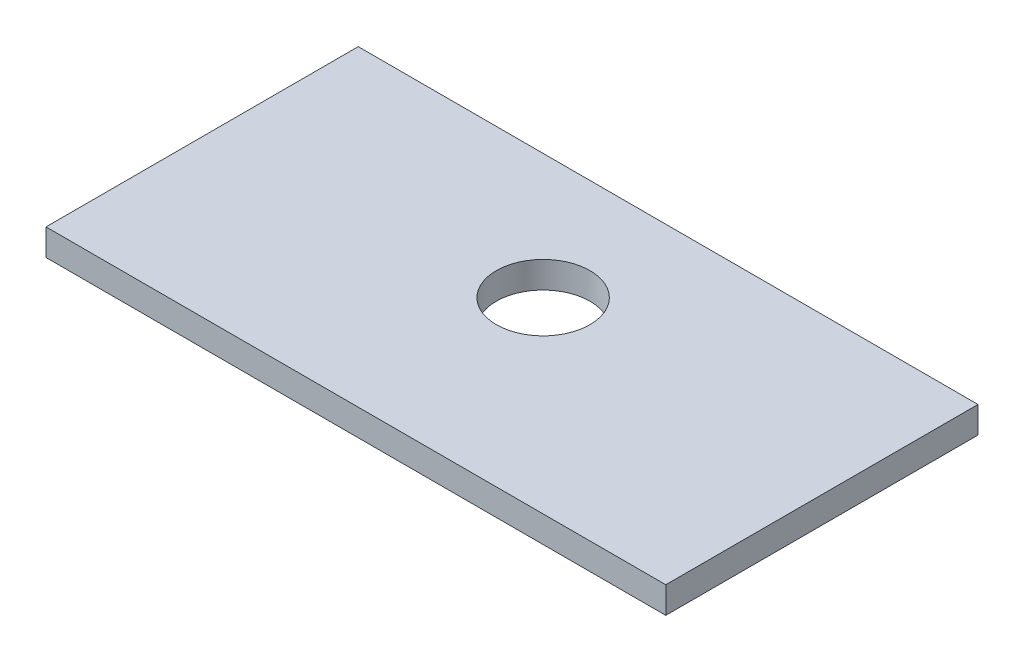
from build123d import *

# Parameters (mm, degrees)
SKETCH1_W           = 99.25
SKETCH1_H           = 4.25
BOSS_EXTRUDE1_DEPTH = 25
CUT_EXTRUDE1_START  = 43.476884
SKETCH2_R           = 7.5
CUT_EXTRUDE1_DEPTH  = 6


with BuildPart() as part:
    # Sketch1 → Boss-Extrude1 (new, symmetric)
    with BuildSketch(Plane.XY):
        with Locations((-4.860782361, 41.351884068)):
            Rectangle(SKETCH1_W, SKETCH1_H)
    extrude(amount=BOSS_EXTRUDE1_DEPTH, both=True)

    # Sketch2 → Cut-Extrude1 (cut)
    with BuildSketch(Plane(origin=(0, 0, 0), x_dir=(1, 0, 0), z_dir=(0, 1, 0)).offset(CUT_EXTRUDE1_START)):
        with Locations(Location((-4.869275063, 4.996031553, 0), (0, 0, 270))):
            Circle(SKETCH2_R)
    extrude(amount=-CUT_EXTRUDE1_DEPTH, mode=Mode.SUBTRACT)


solid = part.part
